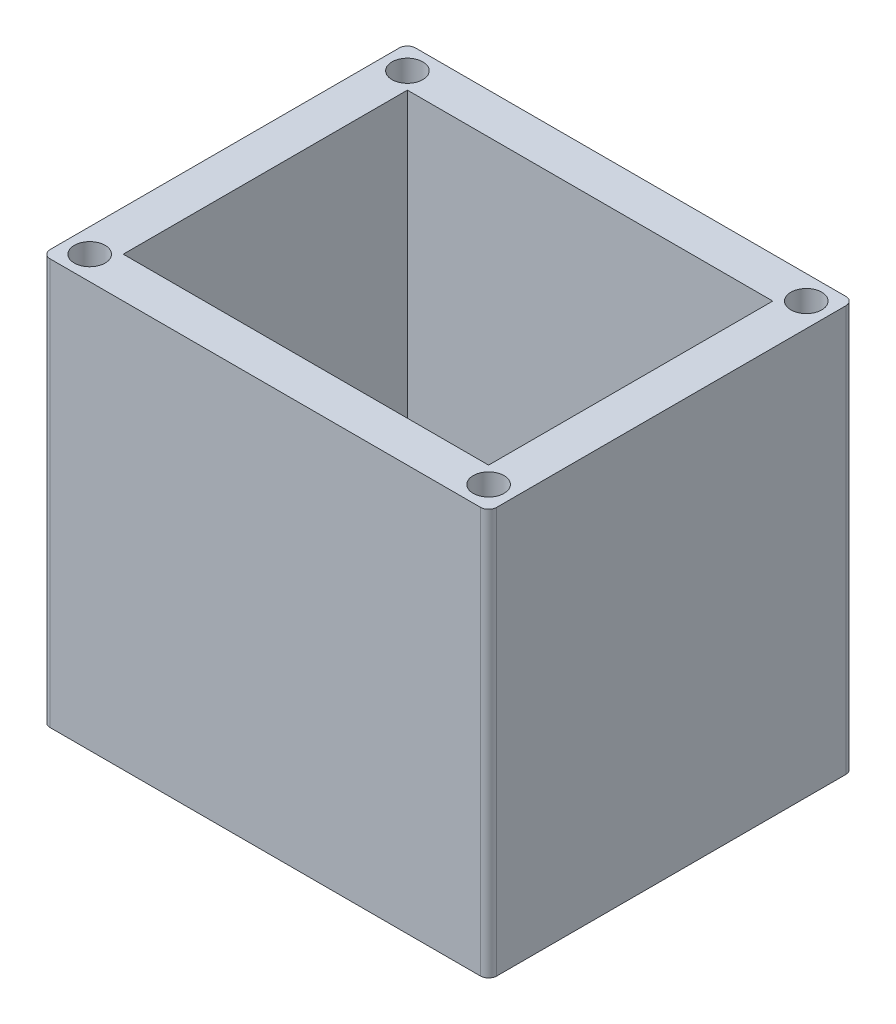
from build123d import *

# Parameters (mm, degrees)
SKETCH1_W           = 55
SKETCH1_H           = 45
BOSS_EXTRUDE1_DEPTH = 50
SKETCH2_W           = 45
SKETCH2_H           = 35
CUT_EXTRUDE1_DEPTH  = 45
SKETCH3_R           = 1.9
CUT_EXTRUDE2_DEPTH  = 20
SKETCH4_R           = 1.6
CUT_EXTRUDE3_DEPTH  = 10
CUT_EXTRUDE4_DEPTH  = 10
FILLET2_R           = 1
FILLET3_R           = 1


with BuildPart() as part:
    # Sketch1 → Boss-Extrude1 (new body)
    with BuildSketch(Plane(origin=(0, 0, 0), x_dir=(1, 0, 0), z_dir=(0, 1, 0))):
        with Locations((27.5, -22.5)):
            Rectangle(SKETCH1_W, SKETCH1_H)
    extrude(amount=BOSS_EXTRUDE1_DEPTH)

    # Sketch2 → Cut-Extrude1 (cut)
    with BuildSketch(Plane(origin=(0, 50, 0), x_dir=(1, 0, 0), z_dir=(0, 1, 0))):
        with Locations((27.5, -22.5)):
            Rectangle(SKETCH2_W, SKETCH2_H)
    extrude(amount=-CUT_EXTRUDE1_DEPTH, mode=Mode.SUBTRACT)

    # Sketch3 → Cut-Extrude2 (cut)
    with BuildSketch(Plane(origin=(0, 50, 0), x_dir=(1, 0, 0), z_dir=(0, 1, 0))):
        with Locations((2.935211994, -2.935211994)):
            Circle(SKETCH3_R)
        with Locations((52.064788006, -2.935211994)):
            Circle(SKETCH3_R)
        with Locations((52.064788006, -42.064788006)):
            Circle(SKETCH3_R)
        with Locations((2.935211994, -42.064788006)):
            Circle(SKETCH3_R)
    extrude(amount=-CUT_EXTRUDE2_DEPTH, mode=Mode.SUBTRACT)

    # Sketch4 → Cut-Extrude3 (cut)
    with BuildSketch(Plane(origin=(0, 5, 0), x_dir=(1, 0, 0), z_dir=(0, 1, 0))):
        with Locations((13.75, -22.5)):
            Circle(SKETCH4_R)
        with Locations((41.25, -22.5)):
            Circle(SKETCH4_R)
    extrude(amount=-CUT_EXTRUDE3_DEPTH, mode=Mode.SUBTRACT)

    # Sketch5 → Cut-Extrude4 (cut)
    with BuildSketch(Plane.ZY):
        Polygon((7.5, 11.987174728), (7.5, 7.5), (37.5, 7.5), (37.5, 12.5), align=None)
    extrude(amount=-CUT_EXTRUDE4_DEPTH, mode=Mode.SUBTRACT)

    # Fillet2
    fillet2_edges = [part.edges().sort_by_distance(p)[0] for p in [
        (55, 25, 45),
        (0, 25, 45),
        (0, 25, 0),
        (55, 25, 0),
    ]]
    fillet(fillet2_edges, radius=FILLET2_R)

    # Fillet3
    fillet3_edges = [part.edges().sort_by_distance(p)[0] for p in [
        (0, 7.5, 22.5),
        (0, 9.743587364, 7.5),
        (0, 12.243587364, 22.5),
        (0, 10, 37.5),
    ]]
    fillet(fillet3_edges, radius=FILLET3_R)


solid = part.part
